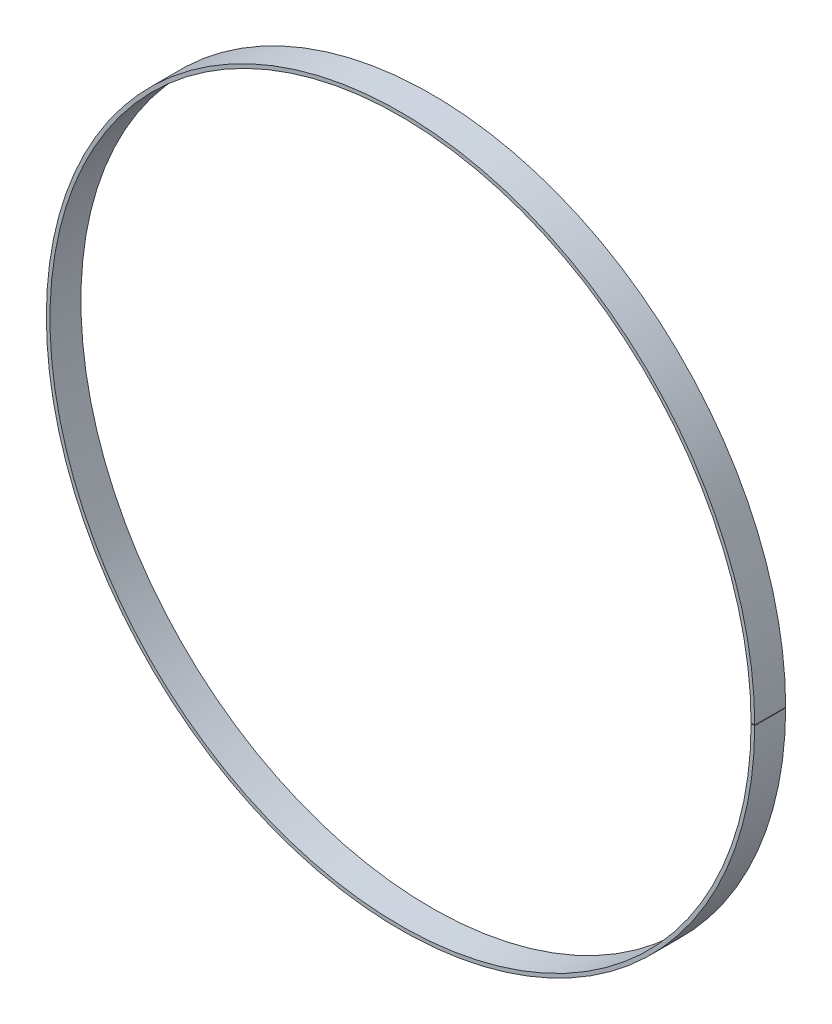
from build123d import *

# Parameters (mm, degrees)
BOSS_EXTRU_1_DEPTH = 13.5


with BuildPart() as part:
    # Esquisse1 → Boss.-Extru.1 (new body)
    with BuildSketch(Plane.XY):
        with BuildLine():
            Line((152.999949981, 0.123716342), (154.587449462, 0.125))
            ThreePointArc((154.587449462, 0.125), (-154.5875, 0), (154.587449462, -0.125))
            Line((154.587449462, -0.125), (152.999949981, -0.123716342))
            ThreePointArc((152.999949981, -0.123716342), (-153, 0), (152.999949981, 0.123716342))
        make_face()
    extrude(amount=BOSS_EXTRU_1_DEPTH)


solid = part.part
